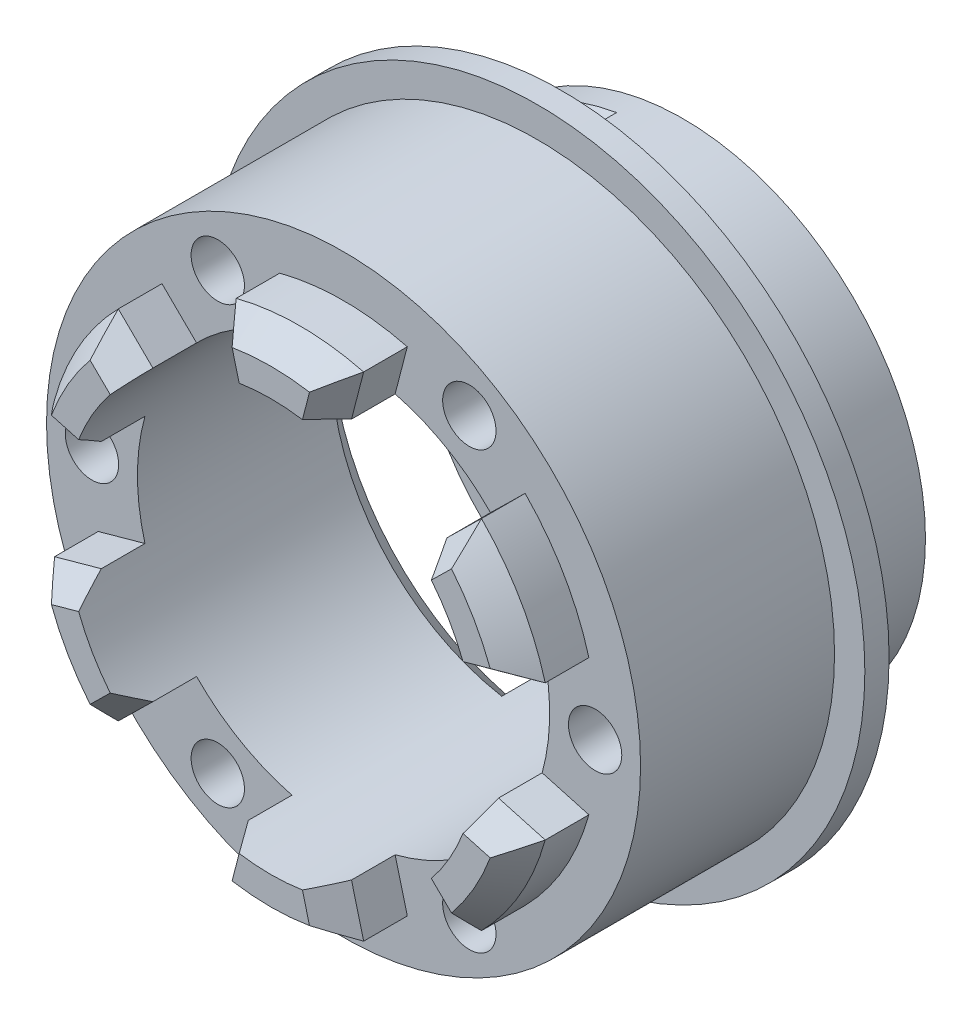
from build123d import *
from OCP.BRepFilletAPI import BRepFilletAPI_MakeChamfer

# Parameters (mm, degrees)
SKETCH_1_R          = 10
EXTRUDE_1_DEPTH     = 2
SKETCH_2_R          = 10
SKETCH_2_R_2        = 8.5
EXTRUDE_2_DEPTH     = 3
SKETCH_4_R          = 13.5
SKETCH_4_R_2        = 8.5
EXTRUDE_3_DEPTH     = 1
SKETCH_5_R          = 12.25
SKETCH_5_R_2        = 8.5
EXTRUDE_4_DEPTH     = 8
SKETCH_6_R          = 1.1
CUT_EXTRUDE_1_DEPTH = 8
SKETCH_7_R          = 3
SKETCH_7_R_2        = 1.15
CUT_EXTRUDE_2_DEPTH = 24.674881204
EXTRUDE_5_DEPTH     = 3
CHAMFER_1_SIZE      = 1.2
CHAMFER_1_SIZE2     = 0.840249046
CUT_EXTRUDE_START   = -2
CUT_EXTRUDE_3_DEPTH = 3
CHAMFER_2_SIZE      = 1


with BuildPart() as part:
    # 스케치1 → 보스-돌출1 (new body)
    with BuildSketch(Plane.XY):
        Circle(SKETCH_1_R)
    extrude(amount=EXTRUDE_1_DEPTH)

    # 스케치2 → 보스-돌출2 (add)
    with BuildSketch(Plane.XY.offset(2)):
        Circle(SKETCH_2_R)
        Circle(SKETCH_2_R_2, mode=Mode.SUBTRACT)
    extrude(amount=EXTRUDE_2_DEPTH)

    # 스케치4 → 보스-돌출3 (add)
    with BuildSketch(Plane.XY.offset(5)):
        Circle(SKETCH_4_R)
        Circle(SKETCH_4_R_2, mode=Mode.SUBTRACT)
    extrude(amount=EXTRUDE_3_DEPTH)

    # 스케치5 → 보스-돌출4 (add)
    with BuildSketch(Plane.XY.offset(6)):
        Circle(SKETCH_5_R)
        Circle(SKETCH_5_R_2, mode=Mode.SUBTRACT)
    extrude(amount=EXTRUDE_4_DEPTH)

    # 스케치6 → 컷-돌출1 (cut)
    with BuildSketch(Plane.XY.offset(14)):
        with Locations((10.375, 0)):
            Circle(SKETCH_6_R)
        with Locations((5.1875, -8.985013564)):
            Circle(SKETCH_6_R)
        with Locations((-5.1875, -8.985013564)):
            Circle(SKETCH_6_R)
        with Locations((-10.375, 0)):
            Circle(SKETCH_6_R)
        with Locations((-5.1875, 8.985013564)):
            Circle(SKETCH_6_R)
        with Locations((5.1875, 8.985013564)):
            Circle(SKETCH_6_R)
    extrude(amount=-CUT_EXTRUDE_1_DEPTH, mode=Mode.SUBTRACT)

    # 스케치7 → 컷-돌출2 (cut, through all)
    with BuildSketch(Plane(origin=(0, 0, 0), x_dir=(-1, 0, 0), z_dir=(0, 0, -1))):
        Circle(SKETCH_7_R)
        with Locations((-7, 0)):
            Circle(SKETCH_7_R_2)
        with Locations((7, 0)):
            Circle(SKETCH_7_R_2)
        with Locations((0, 7)):
            Circle(SKETCH_7_R_2)
        with Locations((0, -7)):
            Circle(SKETCH_7_R_2)
    extrude(amount=-CUT_EXTRUDE_2_DEPTH, mode=Mode.SUBTRACT)

    # 스케치10 → 보스-돌출5 (add)
    with BuildSketch(Plane.XY.offset(14)):
        with BuildLine():
            Line((-2.128230034, 8.229254943), (-2.628990043, 10.165550224))
            ThreePointArc((-2.628990043, 10.165550224), (0, 10.5), (2.628990043, 10.165550224))
            Line((2.628990043, 10.165550224), (2.128230034, 8.229254943))
            ThreePointArc((2.128230034, 8.229254943), (0, 8.5), (-2.128230034, 8.229254943))
        make_face()
        with BuildLine():
            Line((6.062628818, 5.957728747), (7.489129716, 7.359547275))
            ThreePointArc((7.489129716, 7.359547275), (9.09326674, 5.25), (10.118119759, 2.806002949))
            Line((10.118119759, 2.806002949), (8.190858852, 2.271526197))
            ThreePointArc((8.190858852, 2.271526197), (7.361215932, 4.25), (6.062628818, 5.957728747))
        make_face()
        with BuildLine():
            Line((-8.190858852, 2.271526197), (-10.118119759, 2.806002949))
            ThreePointArc((-10.118119759, 2.806002949), (-9.09326674, 5.25), (-7.489129716, 7.359547275))
            Line((-7.489129716, 7.359547275), (-6.062628818, 5.957728747))
            ThreePointArc((-6.062628818, 5.957728747), (-7.361215932, 4.25), (-8.190858852, 2.271526197))
        make_face()
        with BuildLine():
            Line((8.190858852, -2.271526197), (10.118119759, -2.806002949))
            ThreePointArc((10.118119759, -2.806002949), (9.09326674, -5.25), (7.489129716, -7.359547275))
            Line((7.489129716, -7.359547275), (6.062628818, -5.957728747))
            ThreePointArc((6.062628818, -5.957728747), (7.361215932, -4.25), (8.190858852, -2.271526197))
        make_face()
        with BuildLine():
            Line((2.128230034, -8.229254943), (2.628990043, -10.165550224))
            ThreePointArc((2.628990043, -10.165550224), (0, -10.5), (-2.628990043, -10.165550224))
            Line((-2.628990043, -10.165550224), (-2.128230034, -8.229254943))
            ThreePointArc((-2.128230034, -8.229254943), (0, -8.5), (2.128230034, -8.229254943))
        make_face()
        with BuildLine():
            Line((-6.062628818, -5.957728747), (-7.489129716, -7.359547275))
            ThreePointArc((-7.489129716, -7.359547275), (-9.09326674, -5.25), (-10.118119759, -2.806002949))
            Line((-10.118119759, -2.806002949), (-8.190858852, -2.271526197))
            ThreePointArc((-8.190858852, -2.271526197), (-7.361215932, -4.25), (-6.062628818, -5.957728747))
        make_face()
    extrude(amount=EXTRUDE_5_DEPTH)

    # 모따기1: one chamfer whose edges measure the first distance from different faces: ONE call of the kernel's chamfer builder (chamfer() names one face for all edges)
    chamfer_1_edges_1 = [part.edges().sort_by_distance(p)[0] for p in [
        (9.09326674, 5.25, 17),
    ]]
    chamfer_1_side_1 = [part.faces().sort_by_distance(p)[0] for p in [
        (9.09326674, 5.25, 15.5),
    ]]
    chamfer_1_edges_2 = [part.edges().sort_by_distance(p)[0] for p in [
        (6.775879267, 6.658638011, 17),
    ]]
    chamfer_1_side_2 = [part.faces().sort_by_distance(p)[0] for p in [
        (6.775879267, 6.658638011, 15.5),
    ]]
    chamfer_1_edges_3 = [part.edges().sort_by_distance(p)[0] for p in [
        (9.154489305, 2.538764573, 17),
    ]]
    chamfer_1_side_3 = [part.faces().sort_by_distance(p)[0] for p in [
        (9.154489305, 2.538764573, 15.5),
    ]]
    chamfer_1_edges_4 = [part.edges().sort_by_distance(p)[0] for p in [
        (-2.378610039, -9.197402584, 17),
    ]]
    chamfer_1_side_4 = [part.faces().sort_by_distance(p)[0] for p in [
        (-2.378610039, -9.197402584, 15.5),
    ]]
    chamfer_1_edges_5 = [part.edges().sort_by_distance(p)[0] for p in [
        (0, -10.5, 17),
    ]]
    chamfer_1_side_5 = [part.faces().sort_by_distance(p)[0] for p in [
        (0, -10.5, 15.5),
    ]]
    chamfer_1_edges_6 = [part.edges().sort_by_distance(p)[0] for p in [
        (2.378610039, -9.197402584, 17),
    ]]
    chamfer_1_side_6 = [part.faces().sort_by_distance(p)[0] for p in [
        (2.378610039, -9.197402584, 15.5),
    ]]
    chamfer_1_edges_7 = [part.edges().sort_by_distance(p)[0] for p in [
        (9.09326674, -5.25, 17),
    ]]
    chamfer_1_side_7 = [part.faces().sort_by_distance(p)[0] for p in [
        (9.09326674, -5.25, 15.5),
    ]]
    chamfer_1_edges_8 = [part.edges().sort_by_distance(p)[0] for p in [
        (9.154489305, -2.538764573, 17),
    ]]
    chamfer_1_side_8 = [part.faces().sort_by_distance(p)[0] for p in [
        (9.154489305, -2.538764573, 15.5),
    ]]
    chamfer_1_edges_9 = [part.edges().sort_by_distance(p)[0] for p in [
        (6.775879267, -6.658638011, 17),
    ]]
    chamfer_1_side_9 = [part.faces().sort_by_distance(p)[0] for p in [
        (6.775879267, -6.658638011, 15.5),
    ]]
    chamfer_1_edges_10 = [part.edges().sort_by_distance(p)[0] for p in [
        (2.378610039, 9.197402584, 17),
    ]]
    chamfer_1_side_10 = [part.faces().sort_by_distance(p)[0] for p in [
        (2.378610039, 9.197402584, 15.5),
    ]]
    chamfer_1_edges_11 = [part.edges().sort_by_distance(p)[0] for p in [
        (0, 10.5, 17),
    ]]
    chamfer_1_side_11 = [part.faces().sort_by_distance(p)[0] for p in [
        (0, 10.5, 15.5),
    ]]
    chamfer_1_edges_12 = [part.edges().sort_by_distance(p)[0] for p in [
        (-2.378610039, 9.197402584, 17),
    ]]
    chamfer_1_side_12 = [part.faces().sort_by_distance(p)[0] for p in [
        (-2.378610039, 9.197402584, 15.5),
    ]]
    chamfer_1_edges_13 = [part.edges().sort_by_distance(p)[0] for p in [
        (-6.775879267, 6.658638011, 17),
    ]]
    chamfer_1_side_13 = [part.faces().sort_by_distance(p)[0] for p in [
        (-6.775879267, 6.658638011, 15.5),
    ]]
    chamfer_1_edges_14 = [part.edges().sort_by_distance(p)[0] for p in [
        (-9.09326674, 5.25, 17),
    ]]
    chamfer_1_side_14 = [part.faces().sort_by_distance(p)[0] for p in [
        (-9.09326674, 5.25, 15.5),
    ]]
    chamfer_1_edges_15 = [part.edges().sort_by_distance(p)[0] for p in [
        (-9.154489305, 2.538764573, 17),
    ]]
    chamfer_1_side_15 = [part.faces().sort_by_distance(p)[0] for p in [
        (-9.154489305, 2.538764573, 15.5),
    ]]
    chamfer_1_edges_16 = [part.edges().sort_by_distance(p)[0] for p in [
        (-9.154489305, -2.538764573, 17),
    ]]
    chamfer_1_side_16 = [part.faces().sort_by_distance(p)[0] for p in [
        (-9.154489305, -2.538764573, 15.5),
    ]]
    chamfer_1_edges_17 = [part.edges().sort_by_distance(p)[0] for p in [
        (-9.09326674, -5.25, 17),
    ]]
    chamfer_1_side_17 = [part.faces().sort_by_distance(p)[0] for p in [
        (-9.09326674, -5.25, 15.5),
    ]]
    chamfer_1_edges_18 = [part.edges().sort_by_distance(p)[0] for p in [
        (-6.775879267, -6.658638011, 17),
    ]]
    chamfer_1_side_18 = [part.faces().sort_by_distance(p)[0] for p in [
        (-6.775879267, -6.658638011, 15.5),
    ]]
    chamfer_1 = BRepFilletAPI_MakeChamfer(part.part.solid().wrapped)
    for e in chamfer_1_edges_1:
        chamfer_1.Add(CHAMFER_1_SIZE, CHAMFER_1_SIZE2, e.wrapped, chamfer_1_side_1[0].wrapped)  # the first distance lies on this face
    for e in chamfer_1_edges_2:
        chamfer_1.Add(CHAMFER_1_SIZE, CHAMFER_1_SIZE2, e.wrapped, chamfer_1_side_2[0].wrapped)  # the first distance lies on this face
    for e in chamfer_1_edges_3:
        chamfer_1.Add(CHAMFER_1_SIZE, CHAMFER_1_SIZE2, e.wrapped, chamfer_1_side_3[0].wrapped)  # the first distance lies on this face
    for e in chamfer_1_edges_4:
        chamfer_1.Add(CHAMFER_1_SIZE, CHAMFER_1_SIZE2, e.wrapped, chamfer_1_side_4[0].wrapped)  # the first distance lies on this face
    for e in chamfer_1_edges_5:
        chamfer_1.Add(CHAMFER_1_SIZE, CHAMFER_1_SIZE2, e.wrapped, chamfer_1_side_5[0].wrapped)  # the first distance lies on this face
    for e in chamfer_1_edges_6:
        chamfer_1.Add(CHAMFER_1_SIZE, CHAMFER_1_SIZE2, e.wrapped, chamfer_1_side_6[0].wrapped)  # the first distance lies on this face
    for e in chamfer_1_edges_7:
        chamfer_1.Add(CHAMFER_1_SIZE, CHAMFER_1_SIZE2, e.wrapped, chamfer_1_side_7[0].wrapped)  # the first distance lies on this face
    for e in chamfer_1_edges_8:
        chamfer_1.Add(CHAMFER_1_SIZE, CHAMFER_1_SIZE2, e.wrapped, chamfer_1_side_8[0].wrapped)  # the first distance lies on this face
    for e in chamfer_1_edges_9:
        chamfer_1.Add(CHAMFER_1_SIZE, CHAMFER_1_SIZE2, e.wrapped, chamfer_1_side_9[0].wrapped)  # the first distance lies on this face
    for e in chamfer_1_edges_10:
        chamfer_1.Add(CHAMFER_1_SIZE, CHAMFER_1_SIZE2, e.wrapped, chamfer_1_side_10[0].wrapped)  # the first distance lies on this face
    for e in chamfer_1_edges_11:
        chamfer_1.Add(CHAMFER_1_SIZE, CHAMFER_1_SIZE2, e.wrapped, chamfer_1_side_11[0].wrapped)  # the first distance lies on this face
    for e in chamfer_1_edges_12:
        chamfer_1.Add(CHAMFER_1_SIZE, CHAMFER_1_SIZE2, e.wrapped, chamfer_1_side_12[0].wrapped)  # the first distance lies on this face
    for e in chamfer_1_edges_13:
        chamfer_1.Add(CHAMFER_1_SIZE, CHAMFER_1_SIZE2, e.wrapped, chamfer_1_side_13[0].wrapped)  # the first distance lies on this face
    for e in chamfer_1_edges_14:
        chamfer_1.Add(CHAMFER_1_SIZE, CHAMFER_1_SIZE2, e.wrapped, chamfer_1_side_14[0].wrapped)  # the first distance lies on this face
    for e in chamfer_1_edges_15:
        chamfer_1.Add(CHAMFER_1_SIZE, CHAMFER_1_SIZE2, e.wrapped, chamfer_1_side_15[0].wrapped)  # the first distance lies on this face
    for e in chamfer_1_edges_16:
        chamfer_1.Add(CHAMFER_1_SIZE, CHAMFER_1_SIZE2, e.wrapped, chamfer_1_side_16[0].wrapped)  # the first distance lies on this face
    for e in chamfer_1_edges_17:
        chamfer_1.Add(CHAMFER_1_SIZE, CHAMFER_1_SIZE2, e.wrapped, chamfer_1_side_17[0].wrapped)  # the first distance lies on this face
    for e in chamfer_1_edges_18:
        chamfer_1.Add(CHAMFER_1_SIZE, CHAMFER_1_SIZE2, e.wrapped, chamfer_1_side_18[0].wrapped)  # the first distance lies on this face
    add(Compound.cast(chamfer_1.Shape()), mode=Mode.REPLACE)

    # 스케치11 → 컷-돌출3 (cut)
    with BuildSketch(Plane(origin=(0, 0, 0), x_dir=(-1, 0, 0), z_dir=(0, 0, -1)).offset(CUT_EXTRUDE_START)):
        with BuildLine():
            Line((1.736481777, 9.84807753), (0.520944533, 2.954423259))
            ThreePointArc((0.520944533, 2.954423259), (2.298133329, 1.928362829), (3, 0))
            Line((3, 0), (5.85, 0))
            ThreePointArc((5.85, 0), (7, 1.15), (8.15, 0))
            Line((8.15, 0), (10, 0))
            ThreePointArc((10, 0), (7.660444431, 6.427876097), (1.736481777, 9.84807753))
        make_face()
        with BuildLine():
            ThreePointArc((3, 0), (2.298133329, -1.928362829), (0.520944533, -2.954423259))
            Line((0.520944533, -2.954423259), (1.736481777, -9.84807753))
            ThreePointArc((1.736481777, -9.84807753), (7.660444431, -6.427876097), (10, 0))
            Line((10, 0), (8.15, 0))
            ThreePointArc((8.15, 0), (7, -1.15), (5.85, 0))
            Line((5.85, 0), (3, 0))
        make_face()
    extrude(amount=-CUT_EXTRUDE_3_DEPTH, mode=Mode.SUBTRACT)

    # 모따기2
    chamfer_2_edges = [part.edges().sort_by_distance(p)[0] for p in [
        (-8.5, 0, 5),
        (-10, 0, 2),
    ]]
    chamfer(chamfer_2_edges, length=CHAMFER_2_SIZE)


solid = part.part
